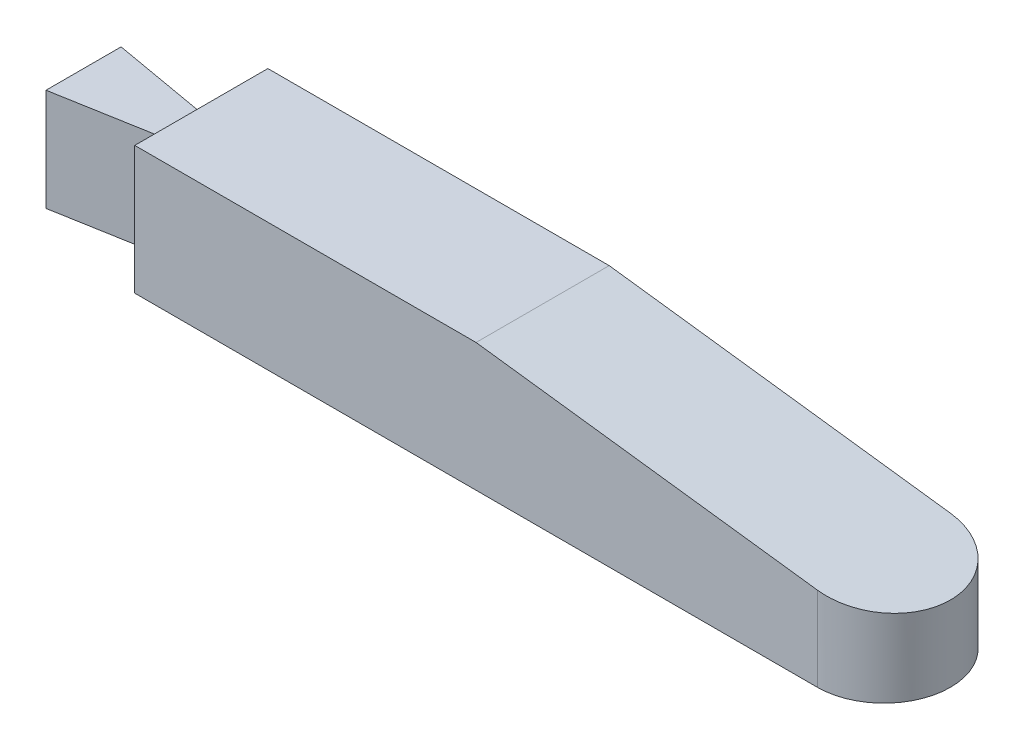
from build123d import *

# Parameters (mm, degrees)
BOSS_EXTRUDE1_DEPTH = 38.1
CUT_EXTRUDE1_DEPTH  = 7.62
CUT_EXTRUDE4_DEPTH  = 39.624


with BuildPart() as part:
    # Sketch2 → Boss-Extrude1 (new body)
    with BuildSketch(Plane(origin=(0, 0, 0), x_dir=(1, 0, 0), z_dir=(0, 1, 0))):
        with BuildLine():
            Line((-35.052, -8.636), (-35.052, -30.988))
            Line((-35.052, -30.988), (0, -24.807386672))
            Line((0, -24.807386672), (0, -39.624))
            Line((0, -39.624), (203.2, -39.624))
            ThreePointArc((203.2, -39.624), (223.012, -19.812), (203.2, 0))
            Line((203.2, 0), (0, 0))
            Line((0, 0), (0, -14.816613328))
            Line((0, -14.816613328), (-35.052, -8.636))
        make_face()
    extrude(amount=BOSS_EXTRUDE1_DEPTH)

    # Sketch3 → Cut-Extrude1 (cut)
    with BuildSketch(Plane(origin=(0, 38.1, 0), x_dir=(1, 0, 0), z_dir=(0, 1, 0))):
        Polygon((-35.052, -8.636), (-35.052, -30.988), (0, -24.807386672), (0, -14.816613328), align=None)
    extrude(amount=-CUT_EXTRUDE1_DEPTH, mode=Mode.SUBTRACT)

    # Sketch5 → Cut-Extrude4 (cut)
    with BuildSketch(Plane.XY.offset(39.624)):
        Polygon((101.6, 38.1), (223.012, 22.519655205), (223.012, 38.1), align=None)
    extrude(amount=-CUT_EXTRUDE4_DEPTH, mode=Mode.SUBTRACT)


solid = part.part
